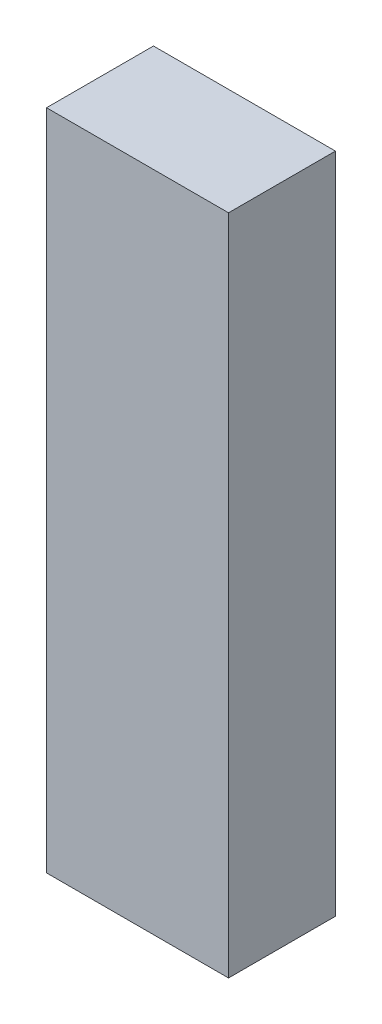
from build123d import *

# Parameters (mm, degrees)
SKETCH2_W           = 5
SKETCH2_H           = 30.99
BOSS_EXTRUDE1_DEPTH = 8.51
SKETCH3_W           = 0.635
SKETCH3_H           = 0.635
CUT_EXTRUDE1_DEPTH  = 4
CHAMFER2_SIZE       = 0.5


with BuildPart() as part:
    # Sketch2 → Boss-Extrude1 (new body)
    with BuildSketch(Plane(origin=(0, 0, 0), x_dir=(0, 0, -1), z_dir=(1, 0, 0))):
        Rectangle(SKETCH2_W, SKETCH2_H)
    extrude(amount=BOSS_EXTRUDE1_DEPTH)

    # Sketch3 → Cut-Extrude1 (cut)
    with BuildSketch(Plane.ZY):
        with Locations((-1.27, 13.965)):
            Rectangle(SKETCH3_W, SKETCH3_H)
        with Locations((1.27, 13.965)):
            Rectangle(SKETCH3_W, SKETCH3_H)
        with Locations((1.27, 11.425)):
            Rectangle(SKETCH3_W, SKETCH3_H)
        with Locations((1.27, 8.885)):
            Rectangle(SKETCH3_W, SKETCH3_H)
        with Locations((1.27, 6.345)):
            Rectangle(SKETCH3_W, SKETCH3_H)
        with Locations((1.27, 3.805)):
            Rectangle(SKETCH3_W, SKETCH3_H)
        with Locations((1.27, 1.265)):
            Rectangle(SKETCH3_W, SKETCH3_H)
        with Locations((1.27, -1.275)):
            Rectangle(SKETCH3_W, SKETCH3_H)
        with Locations((1.27, -3.815)):
            Rectangle(SKETCH3_W, SKETCH3_H)
        with Locations((1.27, -6.355)):
            Rectangle(SKETCH3_W, SKETCH3_H)
        with Locations((1.27, -8.895)):
            Rectangle(SKETCH3_W, SKETCH3_H)
        with Locations((1.27, -11.435)):
            Rectangle(SKETCH3_W, SKETCH3_H)
        with Locations((1.27, -13.975)):
            Rectangle(SKETCH3_W, SKETCH3_H)
        with Locations((-1.27, 11.425)):
            Rectangle(SKETCH3_W, SKETCH3_H)
        with Locations((-1.27, 8.885)):
            Rectangle(SKETCH3_W, SKETCH3_H)
        with Locations((-1.27, 6.345)):
            Rectangle(SKETCH3_W, SKETCH3_H)
        with Locations((-1.27, 3.805)):
            Rectangle(SKETCH3_W, SKETCH3_H)
        with Locations((-1.27, 1.265)):
            Rectangle(SKETCH3_W, SKETCH3_H)
        with Locations((-1.27, -1.275)):
            Rectangle(SKETCH3_W, SKETCH3_H)
        with Locations((-1.27, -3.815)):
            Rectangle(SKETCH3_W, SKETCH3_H)
        with Locations((-1.27, -6.355)):
            Rectangle(SKETCH3_W, SKETCH3_H)
        with Locations((-1.27, -8.895)):
            Rectangle(SKETCH3_W, SKETCH3_H)
        with Locations((-1.27, -11.435)):
            Rectangle(SKETCH3_W, SKETCH3_H)
        with Locations((-1.27, -13.975)):
            Rectangle(SKETCH3_W, SKETCH3_H)
    extrude(amount=-CUT_EXTRUDE1_DEPTH, mode=Mode.SUBTRACT)

    # Chamfer2
    chamfer2_edges = [part.edges().sort_by_distance(p)[0] for p in [
        (0, -6.6725, 1.27),
        (0, -6.355, 1.5875),
        (0, -6.0375, 1.27),
        (0, -6.355, 0.9525),
        (0, -4.1325, 1.27),
        (0, -3.815, 1.5875),
        (0, -3.4975, 1.27),
        (0, -3.815, 0.9525),
        (0, -1.5925, 1.27),
        (0, -1.275, 1.5875),
        (0, -0.9575, 1.27),
        (0, -1.275, 0.9525),
        (0, 0.9475, 1.27),
        (0, 1.265, 1.5875),
        (0, 1.5825, 1.27),
        (0, 1.265, 0.9525),
        (0, 3.4875, 1.27),
        (0, 3.805, 1.5875),
        (0, 4.1225, 1.27),
        (0, 3.805, 0.9525),
        (0, 6.0275, 1.27),
        (0, 6.345, 1.5875),
        (0, 6.6625, 1.27),
        (0, 6.345, 0.9525),
        (0, 8.5675, 1.27),
        (0, 8.885, 1.5875),
        (0, 9.2025, 1.27),
        (0, 8.885, 0.9525),
        (0, 11.1075, 1.27),
        (0, 11.425, 1.5875),
        (0, 11.7425, 1.27),
        (0, 11.425, 0.9525),
        (0, 13.6475, 1.27),
        (0, 13.965, 1.5875),
        (0, 14.2825, 1.27),
        (0, 13.965, 0.9525),
        (0, 0.9475, -1.27),
        (0, 1.265, -0.9525),
        (0, 1.5825, -1.27),
        (0, 1.265, -1.5875),
        (0, -1.5925, -1.27),
        (0, -1.275, -0.9525),
        (0, -0.9575, -1.27),
        (0, -1.275, -1.5875),
        (0, -4.1325, -1.27),
        (0, -3.815, -0.9525),
        (0, -3.4975, -1.27),
        (0, -3.815, -1.5875),
        (0, -6.6725, -1.27),
        (0, -6.355, -0.9525),
        (0, -6.0375, -1.27),
        (0, -6.355, -1.5875),
        (0, -9.2125, -1.27),
        (0, -8.895, -0.9525),
        (0, -8.5775, -1.27),
        (0, -8.895, -1.5875),
        (0, -11.7525, -1.27),
        (0, -11.435, -0.9525),
        (0, -11.1175, -1.27),
        (0, -11.435, -1.5875),
        (0, -14.2925, -1.27),
        (0, -13.975, -0.9525),
        (0, -13.6575, -1.27),
        (0, -13.975, -1.5875),
        (0, 13.965, -0.9525),
        (0, 14.2825, -1.27),
        (0, 13.965, -1.5875),
        (0, 13.6475, -1.27),
        (0, 3.4875, -1.27),
        (0, 3.805, -0.9525),
        (0, 4.1225, -1.27),
        (0, 3.805, -1.5875),
        (0, 6.0275, -1.27),
        (0, 6.345, -0.9525),
        (0, 6.6625, -1.27),
        (0, 6.345, -1.5875),
        (0, 8.5675, -1.27),
        (0, 8.885, -0.9525),
        (0, 9.2025, -1.27),
        (0, 8.885, -1.5875),
        (0, 11.1075, -1.27),
        (0, 11.425, -0.9525),
        (0, 11.7425, -1.27),
        (0, 11.425, -1.5875),
        (0, -14.2925, 1.27),
        (0, -13.975, 1.5875),
        (0, -13.6575, 1.27),
        (0, -13.975, 0.9525),
        (0, -11.7525, 1.27),
        (0, -11.435, 1.5875),
        (0, -11.1175, 1.27),
        (0, -11.435, 0.9525),
        (0, -9.2125, 1.27),
        (0, -8.895, 1.5875),
        (0, -8.5775, 1.27),
        (0, -8.895, 0.9525),
    ]]
    chamfer(chamfer2_edges, length=CHAMFER2_SIZE)


solid = part.part
